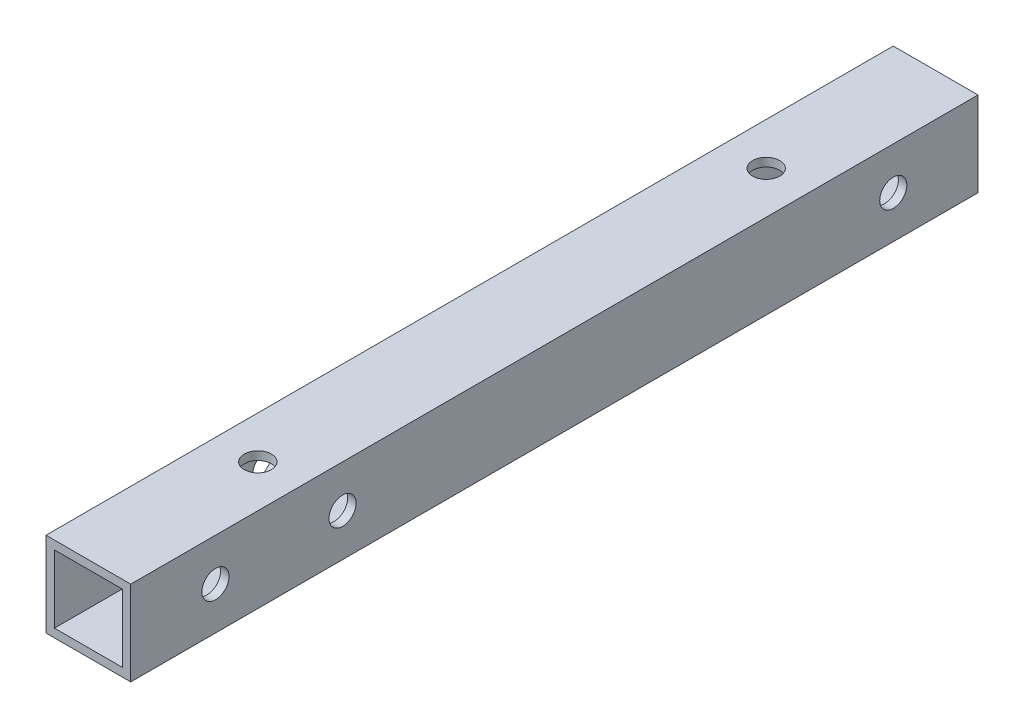
from build123d import *

# Parameters (mm, degrees)
SKETCH_1_W          = 10
SKETCH_1_H          = 10
SKETCH_1_W_2        = 8
SKETCH_1_H_2        = 8
EXTRUDE_1_DEPTH     = 100
SKETCH_2_R          = 1.6
CUT_EXTRUDE_1_DEPTH = 101.623058987
SKETCH_3_R          = 1.6
CUT_EXTRUDE_2_DEPTH = 101.623058987
SKETCH_4_R          = 1.6
CUT_EXTRUDE_3_DEPTH = 101.623058987


with BuildPart() as part:
    # ｽｹｯﾁ1 → ﾎﾞｽ - 押し出し1 (new body)
    with BuildSketch(Plane.XY):
        Rectangle(SKETCH_1_W, SKETCH_1_H)
        Rectangle(SKETCH_1_W_2, SKETCH_1_H_2, mode=Mode.SUBTRACT)
    extrude(amount=EXTRUDE_1_DEPTH)

    # ｽｹｯﾁ2 → ｶｯﾄ - 押し出し1 (cut, through all)
    with BuildSketch(Plane(origin=(0, 5, 0), x_dir=(1, 0, 0), z_dir=(0, 1, 0))):
        with Locations(Location((0, -20, 0), (0, 0, 270))):
            Circle(SKETCH_2_R)
        with Locations(Location((0, -80, 0), (0, 0, 270))):
            Circle(SKETCH_2_R)
    extrude(amount=-CUT_EXTRUDE_1_DEPTH, mode=Mode.SUBTRACT)

    # ｽｹｯﾁ3 → ｶｯﾄ - 押し出し2 (cut, through all)
    with BuildSketch(Plane.ZY.offset(5)):
        with Locations(Location((10, 0, 0), (0, 0, 270))):
            Circle(SKETCH_3_R)
        with Locations(Location((90, 0, 0), (0, 0, 270))):
            Circle(SKETCH_3_R)
    extrude(amount=-CUT_EXTRUDE_2_DEPTH, mode=Mode.SUBTRACT)

    # ｽｹｯﾁ4 → ｶｯﾄ - 押し出し3 (cut, through all)
    with BuildSketch(Plane(origin=(5, 0, 0), x_dir=(0, 0, -1), z_dir=(1, 0, 0))):
        with Locations(Location((-75, 0, 0), (0, 0, 90))):
            Circle(SKETCH_4_R)
    extrude(amount=-CUT_EXTRUDE_3_DEPTH, mode=Mode.SUBTRACT)


solid = part.part
